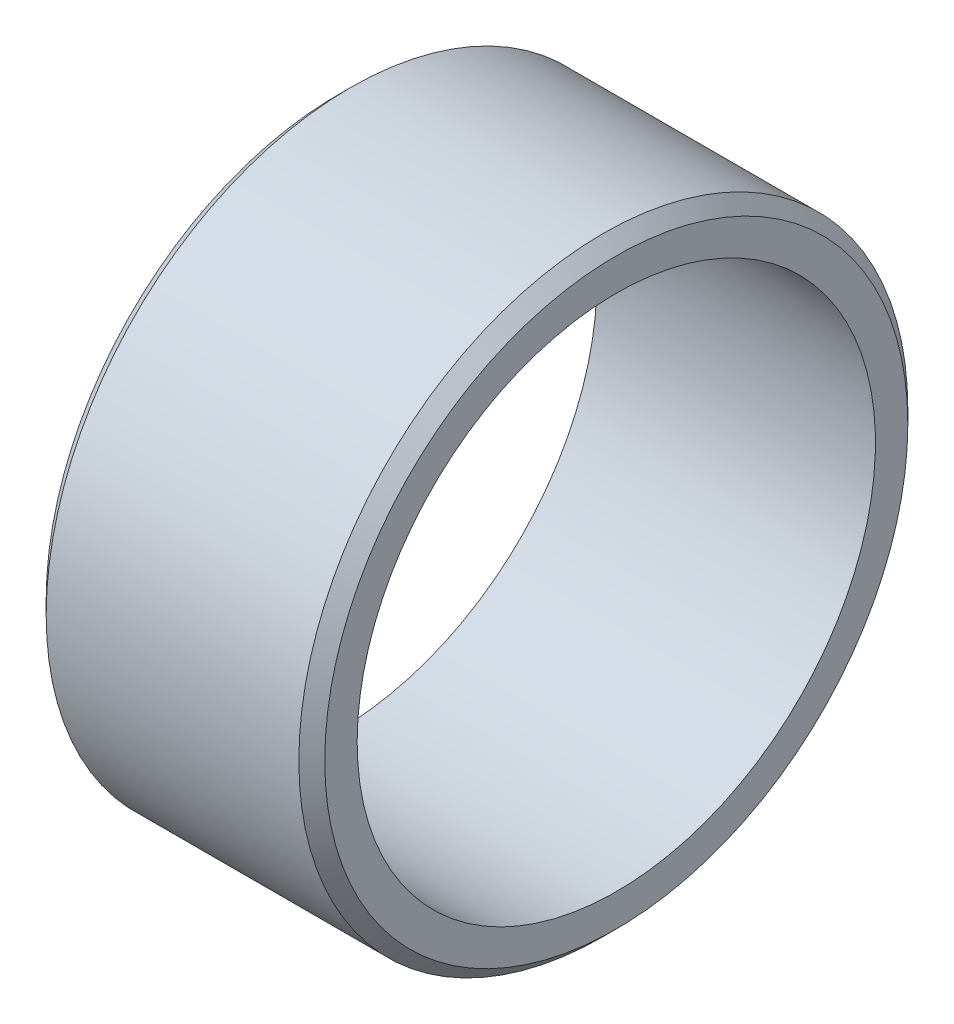
from build123d import *


with BuildPart() as part:
    # Esquisse1 → Révolution1 (revolve)
    with BuildSketch(Plane.XY, mode=Mode.PRIVATE) as r_volution1_sk:
        Polygon((-1, 23.5), (0, 22.5), (0, 20), (-21.5, 20), (-21.5, 22.5), (-20.5, 23.5), align=None)
    revolve(r_volution1_sk.sketch.rotate(Axis((-20.6639399, 0, 0), (1, 0, 0)), 90), axis=Axis((-20.6639399, 0, 0), (1, 0, 0)))


solid = part.part
